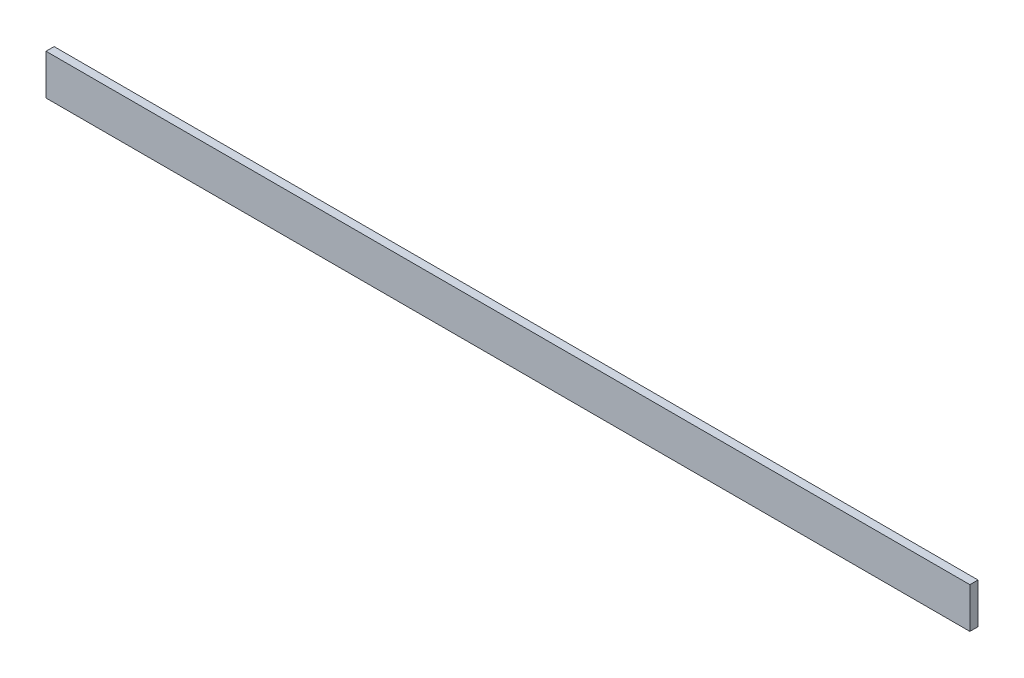
from build123d import *

# Parameters (mm, degrees)
SKETCH_1_W      = 114
SKETCH_1_H      = 5
EXTRUDE_1_DEPTH = 1


with BuildPart() as part:
    # 草图1 → 凸台-拉伸1 (new body)
    with BuildSketch(Plane.XY):
        Rectangle(SKETCH_1_W, SKETCH_1_H)
    extrude(amount=EXTRUDE_1_DEPTH)


solid = part.part
